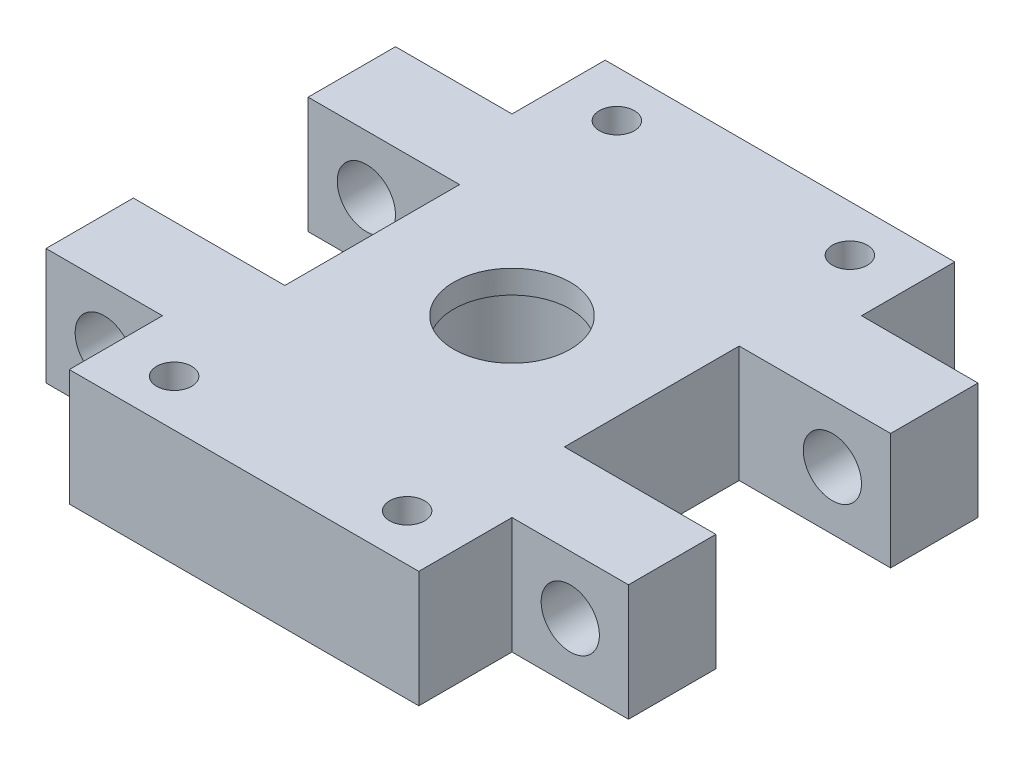
from build123d import *

# Parameters (mm, degrees)
SKETCH9_R           = 5
BOSS_EXTRUDE5_DEPTH = 5
SKETCH10_R          = 2.5
CUT_EXTRUDE5_DEPTH  = 46.760244755
SKETCH11_R          = 6
CUT_EXTRUDE6_DEPTH  = 8
SKETCH12_R          = 1.5
CUT_EXTRUDE7_DEPTH  = 36.411862419


with BuildPart() as part:
    # Sketch9 → Boss-Extrude5 (new, symmetric)
    with BuildSketch(Plane(origin=(0, 0, 0), x_dir=(1, 0, 0), z_dir=(0, 1, 0))):
        Polygon((12, 7.5), (12, -7.5), (25, -7.5), (25, -15), (15, -15), (15, -23), (-15, -23), (-15, -15), (-25, -15), (-25, -7.5), (-12, -7.5), (-12, 7.5), (-25, 7.5), (-25, 15), (-15, 15), (-15, 23), (15, 23), (15, 15), (25, 15), (25, 7.5), align=None)
        with Locations(Location((0, 0, 0), (0, 0, 270))):
            Circle(SKETCH9_R, mode=Mode.SUBTRACT)
    extrude(amount=BOSS_EXTRUDE5_DEPTH, both=True)

    # Sketch10 → Cut-Extrude5 (cut, through all)
    with BuildSketch(Plane(origin=(0, 0, -15), x_dir=(-1, 0, 0), z_dir=(0, 0, -1))):
        with Locations((20, 0)):
            Circle(SKETCH10_R)
        with Locations((-20, 0)):
            Circle(SKETCH10_R)
    extrude(amount=-CUT_EXTRUDE5_DEPTH, mode=Mode.SUBTRACT)

    # Sketch11 → Cut-Extrude6 (cut)
    with BuildSketch(Plane.XZ.offset(5)):
        with Locations(Location((0, 0, 0), (0, 0, 270))):
            Circle(SKETCH11_R)
    extrude(amount=-CUT_EXTRUDE6_DEPTH, mode=Mode.SUBTRACT)

    # Sketch12 → Cut-Extrude7 (cut, through all)
    with BuildSketch(Plane(origin=(0, 5, 0), x_dir=(1, 0, 0), z_dir=(0, 1, 0))):
        with Locations(Location((10, 19, 0), (0, 0, 270))):
            Circle(SKETCH12_R)
        with Locations(Location((-10, 19, 0), (0, 0, 90))):
            Circle(SKETCH12_R)
        with Locations(Location((10, -19, 0), (0, 0, 90))):
            Circle(SKETCH12_R)
        with Locations(Location((-10, -19, 0), (0, 0, 270))):
            Circle(SKETCH12_R)
    extrude(amount=-CUT_EXTRUDE7_DEPTH, mode=Mode.SUBTRACT)


solid = part.part
